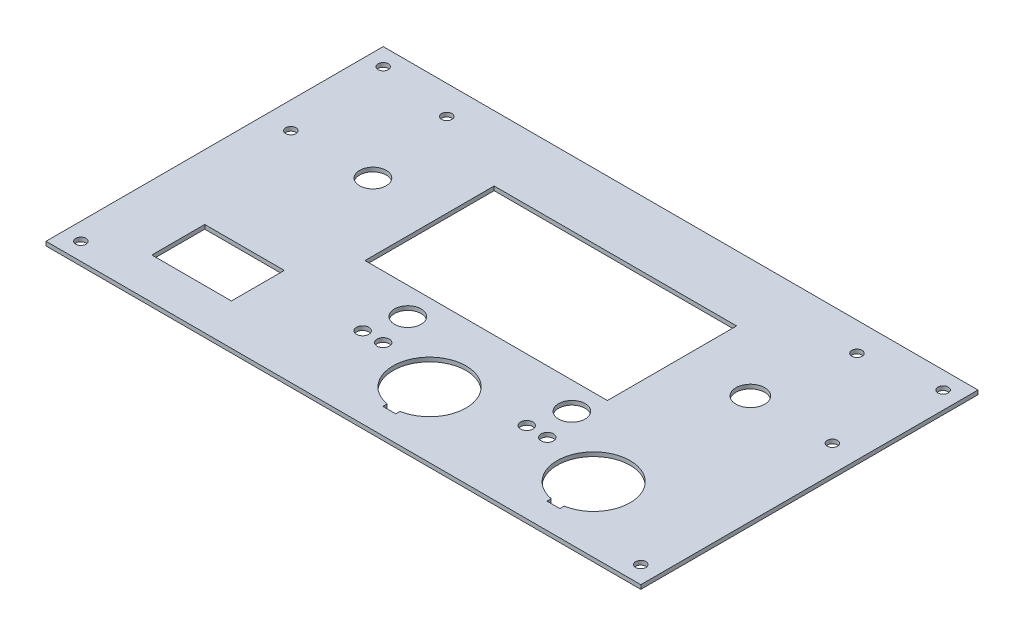
from build123d import *

# Parameters (mm, degrees)
SKETCH2_W           = 145
SKETCH2_H           = 82.2
SKETCH2_R           = 1.25
SKETCH2_R_2         = 1.5
SKETCH2_R_3         = 3.25
SKETCH2_R_4         = 3.5
SKETCH2_W_2         = 19.4
SKETCH2_H_2         = 12.9
SKETCH2_W_3         = 59.1
SKETCH2_H_3         = 31.49
BOSS_EXTRUDE1_DEPTH = 1


with BuildPart() as part:
    # Sketch2 → Boss-Extrude1 (new body)
    with BuildSketch(Plane(origin=(0, 0, 0), x_dir=(1, 0, 0), z_dir=(0, 1, 0))):
        Rectangle(SKETCH2_W, SKETCH2_H)
        with Locations(Location((-68.25, -36.85, 0), (0, 0, 270))):
            Circle(SKETCH2_R, mode=Mode.SUBTRACT)
        with Locations(Location((68.25, -36.85, 0), (0, 0, 270))):
            Circle(SKETCH2_R, mode=Mode.SUBTRACT)
        with Locations(Location((-10, -21.4, 0), (0, 0, 270))):
            Circle(SKETCH2_R_2, mode=Mode.SUBTRACT)
        with Locations(Location((30, -21.4, 0), (0, 0, 270))):
            Circle(SKETCH2_R_2, mode=Mode.SUBTRACT)
        with Locations(Location((-15, -21.4, 0), (0, 0, 270))):
            Circle(SKETCH2_R_2, mode=Mode.SUBTRACT)
        with Locations(Location((25, -21.4, 0), (0, 0, 270))):
            Circle(SKETCH2_R_2, mode=Mode.SUBTRACT)
        with Locations(Location((-12.5, -12.9, 0), (0, 0, 270))):
            Circle(SKETCH2_R_3, mode=Mode.SUBTRACT)
        with Locations(Location((-46, 12.1, 0), (0, 0, 270))):
            Circle(SKETCH2_R_3, mode=Mode.SUBTRACT)
        with Locations(Location((46, 12.1, 0), (0, 0, 270))):
            Circle(SKETCH2_R_4, mode=Mode.SUBTRACT)
        with Locations(Location((-68.25, 36.85, 0), (0, 0, 270))):
            Circle(SKETCH2_R, mode=Mode.SUBTRACT)
        with Locations(Location((68.25, 36.85, 0), (0, 0, 270))):
            Circle(SKETCH2_R, mode=Mode.SUBTRACT)
        with Locations(Location((-66, 12.1, 0), (0, 0, 270))):
            Circle(SKETCH2_R, mode=Mode.SUBTRACT)
        with Locations(Location((-50, 34.1, 0), (0, 0, 270))):
            Circle(SKETCH2_R, mode=Mode.SUBTRACT)
        with Locations(Location((66, 12.1, 0), (0, 0, 90))):
            Circle(SKETCH2_R, mode=Mode.SUBTRACT)
        with Locations(Location((50, 34.1, 0), (0, 0, 90))):
            Circle(SKETCH2_R, mode=Mode.SUBTRACT)
        with Locations(Location((27.5, -12.9, 0), (0, 0, 270))):
            Circle(SKETCH2_R_3, mode=Mode.SUBTRACT)
        with BuildLine():
            Line((3.425, -33.859530524), (3.425, -34.9))
            Line((3.425, -34.9), (6.575, -34.9))
            Line((6.575, -34.9), (6.575, -33.859530524))
            ThreePointArc((6.575, -33.859530524), (5, -16.2), (3.425, -33.859530524))
        make_face(mode=Mode.SUBTRACT)
        with BuildLine():
            Line((43.425, -34.9), (43.425, -33.859530524))
            ThreePointArc((43.425, -33.859530524), (45, -16.2), (46.575, -33.859530524))
            Line((46.575, -33.859530524), (46.575, -34.9))
            Line((46.575, -34.9), (43.425, -34.9))
        make_face(mode=Mode.SUBTRACT)
        with Locations((-47, -24.65)):
            Rectangle(SKETCH2_W_2, SKETCH2_H_2, mode=Mode.SUBTRACT)
        with Locations((0, 9.455)):
            Rectangle(SKETCH2_W_3, SKETCH2_H_3, mode=Mode.SUBTRACT)
    extrude(amount=BOSS_EXTRUDE1_DEPTH)


solid = part.part
